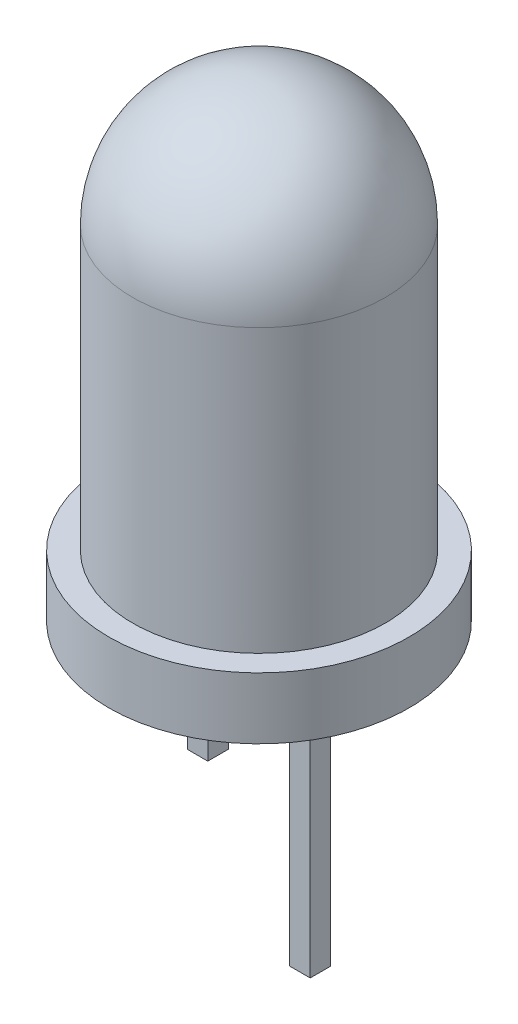
from build123d import *

# Parameters (mm, degrees)
SKETCH3_W           = 0.381
SKETCH3_H           = 0.381
BOSS_EXTRUDE1_DEPTH = 5.08
SKETCH3_4_W         = 0.381
SKETCH3_4_H         = 0.381
BOSS_EXTRUDE2_DEPTH = 2.54
ECHELLE1_SCALE      = 4


with BuildPart() as part:
    # Sketch2 → Revolve1 (revolve)
    with BuildSketch(Plane.XY):
        with BuildLine():
            Line((0, 0), (2.794, 0))
            Line((2.794, 0), (2.794, 1.143))
            Line((2.794, 1.143), (2.3495, 1.143))
            Line((2.3495, 1.143), (2.3495, 6.3881))
            ThreePointArc((2.3495, 6.3881), (1.661347382, 8.049447382), (0, 8.7376))
            Line((0, 8.7376), (0, 0))
        make_face()
    revolve(axis=Axis((0, 0, 0), (0, 1, 0)))

    # Sketch3 → Boss-Extrude1 (add)
    with BuildSketch(Plane.XZ):
        with Locations((0.9525, 0)):
            Rectangle(SKETCH3_W, SKETCH3_H)
    extrude(amount=BOSS_EXTRUDE1_DEPTH)

    # Sketch3<4> → Boss-Extrude2 (add)
    with BuildSketch(Plane.XZ):
        with Locations((-0.9525, 0)):
            Rectangle(SKETCH3_4_W, SKETCH3_4_H)
    extrude(amount=BOSS_EXTRUDE2_DEPTH)


with BuildPart() as part_1:
    # Echelle1: scaled about (0.002384831, 3.75963667, 0)
    add(part.part.scale(ECHELLE1_SCALE).moved(Location((-0.007154493, -11.27891001, 0))))


solid = part_1.part
